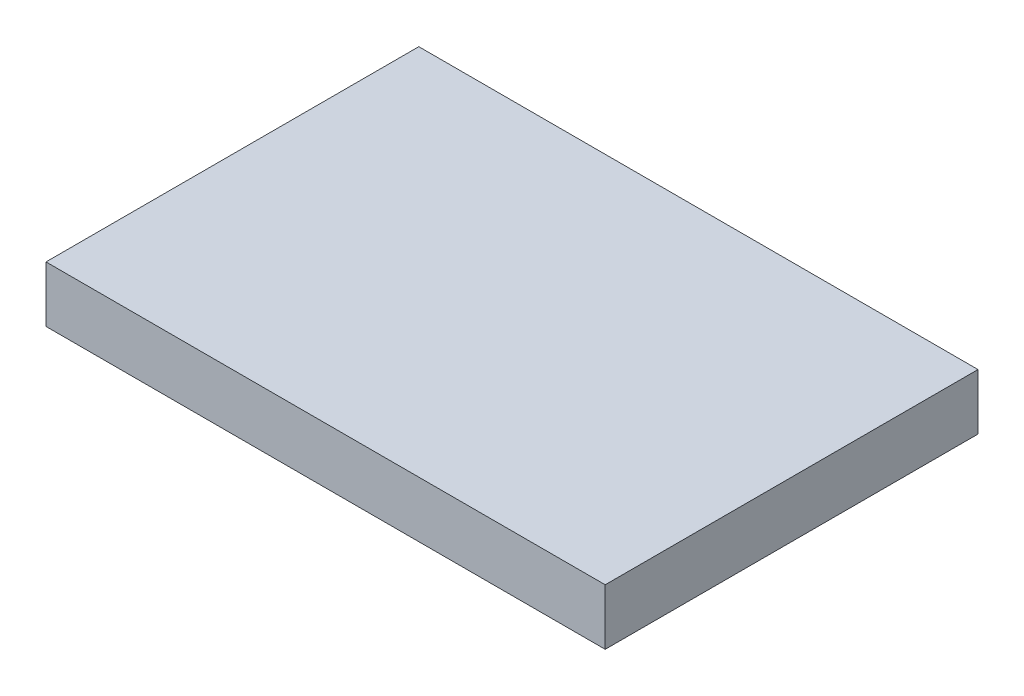
from build123d import *

# Parameters (mm, degrees)
SKETCH1_W           = 30
SKETCH1_H           = 20
BOSS_EXTRUDE1_DEPTH = 3


with BuildPart() as part:
    # Sketch1 → Boss-Extrude1 (new body)
    with BuildSketch(Plane(origin=(0, 0, 0), x_dir=(1, 0, 0), z_dir=(0, 1, 0))):
        with Locations((15, 10)):
            Rectangle(SKETCH1_W, SKETCH1_H)
    extrude(amount=BOSS_EXTRUDE1_DEPTH)


solid = part.part
